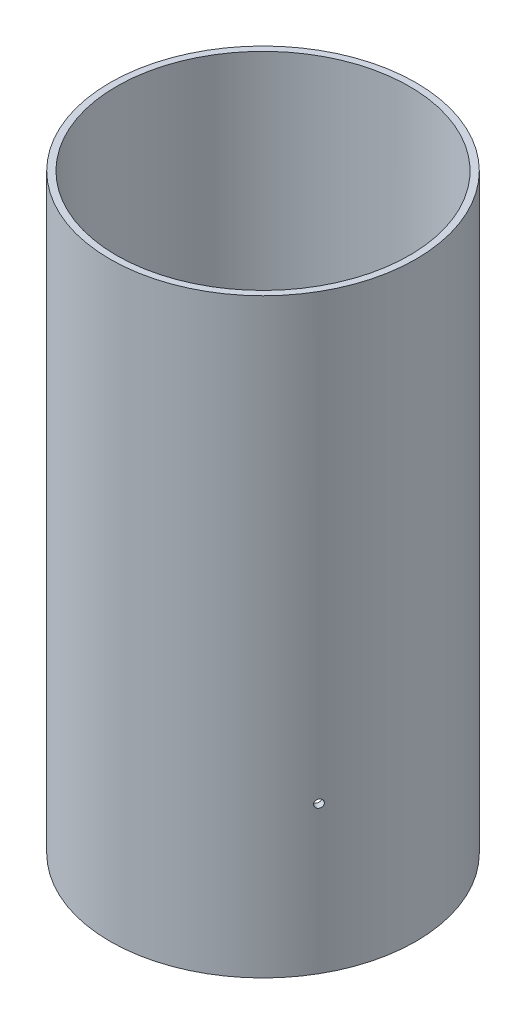
from build123d import *

# Parameters (mm, degrees)
SKETCH1_R                = 38.1381
SKETCH1_R_2              = 36.5125
BOSS_EXTRUDE1_DEPTH      = 147.32
SHEAR_PIN_CUT_REACH      = 175.322
SHEAR_PIN_CUT_END_RADIUS = 36.5125
SKETCH2_R                = 0.9906
SHEAR_PIN_PATTERN_COUNT  = 3


with BuildPart() as part:
    # Sketch1 → Boss-Extrude1 (new body)
    with BuildSketch(Plane(origin=(0, 0, 0), x_dir=(1, 0, 0), z_dir=(0, 1, 0))):
        with Locations(Location((0, 0, 0), (0, 0, 270))):
            Circle(SKETCH1_R)
        with Locations(Location((0, 0, 0), (0, 0, 270))):
            Circle(SKETCH1_R_2, mode=Mode.SUBTRACT)
    extrude(amount=BOSS_EXTRUDE1_DEPTH)

    # Shear Pin Cut: up to this cylinder (the profile starts outside it)
    shear_pin_cut_end = Plane(origin=(0, 36.7284, 0), z_dir=(0, -1, 0)) * Cylinder(SHEAR_PIN_CUT_END_RADIUS, 424.669, mode=Mode.PRIVATE)
    # Sketch2 → Shear Pin Cut (cut, up to the surface)
    with BuildSketch(Plane(origin=(33.028563452, 0, 19.06905), x_dir=(0, -1, 0), z_dir=(0.866025403784438, 0, 0.500000000000001)), mode=Mode.PRIVATE) as shear_pin_cut_sk1:
        with Locations(Location((-36.7284, 0, 0), (0, 0, 90))):
            Circle(SKETCH2_R)
    shear_pin_cut_tool1 = extrude(shear_pin_cut_sk1.sketch, amount=-SHEAR_PIN_CUT_REACH, mode=Mode.PRIVATE) - shear_pin_cut_end
    shear_pin_cut = shear_pin_cut_tool1.solids().sort_by_distance((33.028563, 36.7284, 19.06905))[0]
    add(shear_pin_cut, mode=Mode.SUBTRACT)

    # Shear Pin Pattern: Shear Pin Cut ×3 about axis
    shear_pin_pattern_axis = Axis((0, 155.08605, 0), (0, -1, 0))
    for i in range(1, SHEAR_PIN_PATTERN_COUNT):
        add(shear_pin_cut.rotate(shear_pin_pattern_axis, i * 360 / SHEAR_PIN_PATTERN_COUNT), mode=Mode.SUBTRACT)


solid = part.part
